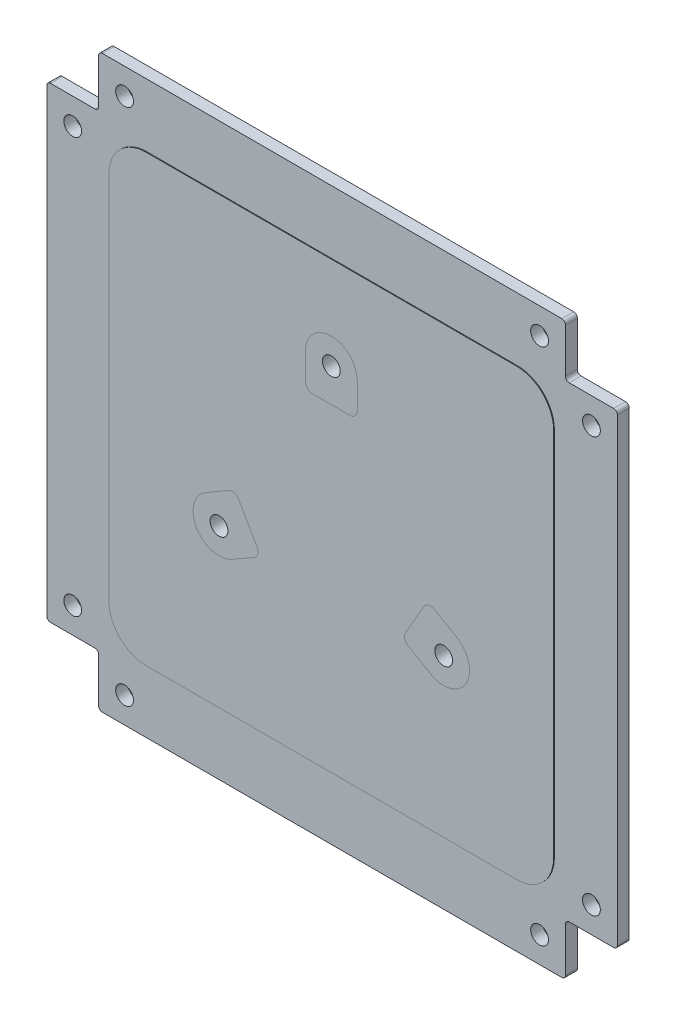
from build123d import *

# Parameters (mm, degrees)
BOSS_EXTRUDE1_DEPTH            = 1.6
BOSS_EXTRUDE2_DEPTH            = 0.1
M2_HOLE1_FIXINGSTRUCTURE_D     = 2.4
M2_HOLE1_FIXINGSTRUCTURE_DEPTH = 200
M2_HOLE1_FIXINGSTRUCTURE_TIP   = 0.721032743
SKETCH4_R                      = 1.2
CUT_EXTRUDE1_DEPTH             = 1.7


with BuildPart() as part:
    # Sketch1 → Boss-Extrude1 (new body)
    with BuildSketch(Plane.XY):
        with BuildLine():
            Line((-31.5, 38), (-31.5, 32))
            ThreePointArc((-31.5, 32), (-31.646446609, 31.646446609), (-32, 31.5))
            Line((-32, 31.5), (-38, 31.5))
            ThreePointArc((-38, 31.5), (-38.353553391, 31.353553391), (-38.5, 31))
            Line((-38.5, 31), (-38.5, -31))
            ThreePointArc((-38.5, -31), (-38.353553391, -31.353553391), (-38, -31.5))
            Line((-38, -31.5), (-32, -31.5))
            ThreePointArc((-32, -31.5), (-31.646446609, -31.646446609), (-31.5, -32))
            Line((-31.5, -32), (-31.5, -38))
            ThreePointArc((-31.5, -38), (-31.353553391, -38.353553391), (-31, -38.5))
            Line((-31, -38.5), (31, -38.5))
            ThreePointArc((31, -38.5), (31.353553391, -38.353553391), (31.5, -38))
            Line((31.5, -38), (31.5, -32))
            ThreePointArc((31.5, -32), (31.646446609, -31.646446609), (32, -31.5))
            Line((32, -31.5), (38, -31.5))
            ThreePointArc((38, -31.5), (38.353553391, -31.353553391), (38.5, -31))
            Line((38.5, -31), (38.5, 31))
            ThreePointArc((38.5, 31), (38.353553391, 31.353553391), (38, 31.5))
            Line((38, 31.5), (32, 31.5))
            ThreePointArc((32, 31.5), (31.646446609, 31.646446609), (31.5, 32))
            Line((31.5, 32), (31.5, 38))
            ThreePointArc((31.5, 38), (31.353553391, 38.353553391), (31, 38.5))
            Line((31, 38.5), (-31, 38.5))
            ThreePointArc((-31, 38.5), (-31.353553391, 38.353553391), (-31.5, 38))
        make_face()
    extrude(amount=BOSS_EXTRUDE1_DEPTH)

    # Esboço1 → Boss-Extrude2 (add)
    with BuildSketch(Plane.XY.offset(1.6)):
        with BuildLine():
            Line((-25, -30), (25, -30))
            ThreePointArc((25, -30), (28.535533906, -28.535533906), (30, -25))
            Line((30, -25), (30, 25))
            ThreePointArc((30, 25), (28.535533906, 28.535533906), (25, 30))
            Line((25, 30), (-25, 30))
            ThreePointArc((-25, 30), (-28.535533906, 28.535533906), (-30, 25))
            Line((-30, 25), (-30, -25))
            ThreePointArc((-30, -25), (-28.535533906, -28.535533906), (-25, -30))
        make_face()
    extrude(amount=BOSS_EXTRUDE2_DEPTH)

    # M2 Hole1-FixingStructure
    with Locations(Plane(origin=(0, 0, 0), x_dir=(-1, 0, 0), z_dir=(0, 0, -1))):
        with Locations((-28, 35), (28, 35), (-28, -35), (28, -35), (35, 28), (35, -28), (-35, -28), (-35, 28)):
            Hole(M2_HOLE1_FIXINGSTRUCTURE_D / 2, depth=M2_HOLE1_FIXINGSTRUCTURE_DEPTH)
            with Locations((0, 0, -(M2_HOLE1_FIXINGSTRUCTURE_DEPTH + M2_HOLE1_FIXINGSTRUCTURE_TIP / 2))):  # 118° drill point
                Cone(0, M2_HOLE1_FIXINGSTRUCTURE_D / 2, M2_HOLE1_FIXINGSTRUCTURE_TIP, mode=Mode.SUBTRACT)

    # Sketch4 → Cut-Extrude1 (cut)
    with BuildSketch(Plane.XY.offset(1.7)):
        with Locations((-15.155444566, -8.75)):
            Circle(SKETCH4_R)
        with Locations((15.155444566, -8.75)):
            Circle(SKETCH4_R)
        with Locations((0, 17.5)):
            Circle(SKETCH4_R)
    extrude(amount=-CUT_EXTRUDE1_DEPTH, mode=Mode.SUBTRACT)


solid = part.part
